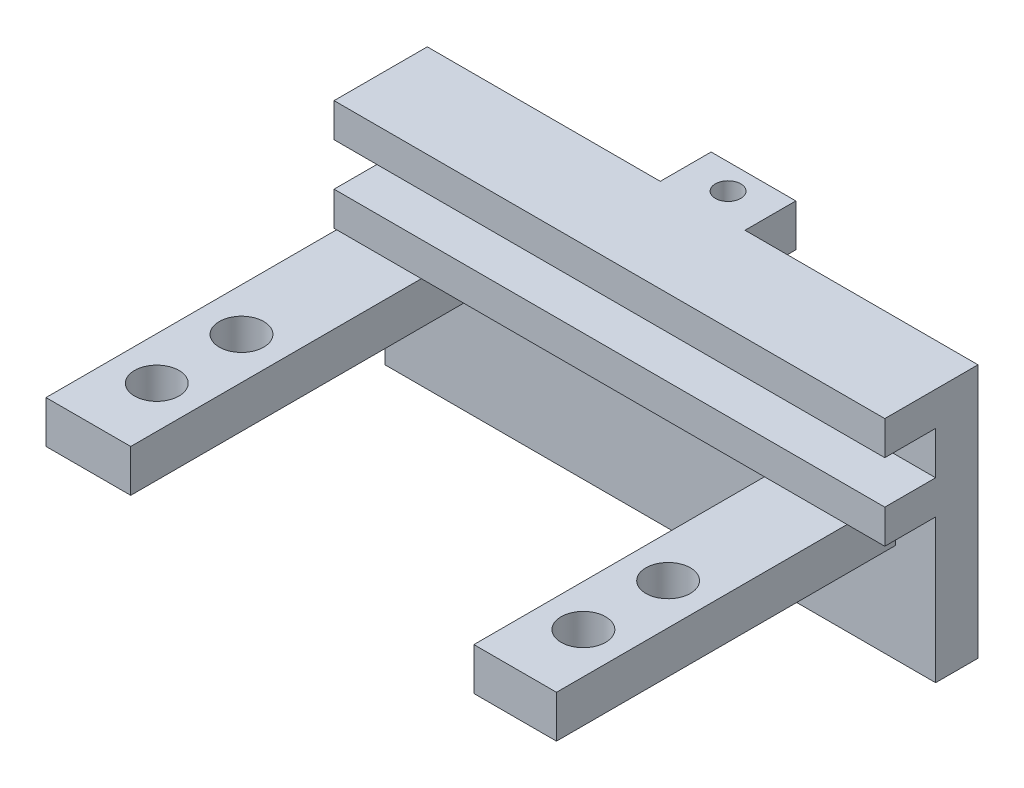
from build123d import *

# Parameters (mm, degrees)
ESQUISSE1_W             = 60
ESQUISSE1_H             = 30
BOSS_EXTRU_1_DEPTH      = 5
ESQUISSE2_W             = 60
ESQUISSE2_H             = 4
BOSS_EXTRU_2_DEPTH      = 6
ESQUISSE3_W             = 5
ESQUISSE3_H             = 5
BOSS_EXTRU_3_DEPTH      = 40
ESQUISSE5_W             = 40
ESQUISSE5_H             = 5
BOSS_EXTRU_4_DEPTH      = 3
ESQUISSE6_W             = 40
ESQUISSE6_H             = 5
BOSS_EXTRU_5_DEPTH      = 3
ESQUISSE7_R             = 2.625
ENL_V_MAT_EXTRU_1_DEPTH = 59.742850629
BOSS_EXTRU_6_DEPTH      = 5
ESQUISSE10_W            = 40
ESQUISSE10_H            = 5
BOSS_EXTRU_7_DEPTH      = 2
ESQUISSE11_W            = 40
ESQUISSE11_H            = 5
BOSS_EXTRU_8_DEPTH      = 1.75
ESQUISSE13_W            = 10
ESQUISSE13_H            = 6
ESQUISSE13_R            = 1.5
BOSS_EXTRU_10_DEPTH     = 5


with BuildPart() as part:
    # Esquisse1 → Boss.-Extru.1 (new body)
    with BuildSketch(Plane.XY):
        Rectangle(ESQUISSE1_W, ESQUISSE1_H)
    extrude(amount=BOSS_EXTRU_1_DEPTH)

    # Esquisse2 → Boss.-Extru.2 (add)
    with BuildSketch(Plane.XY.offset(5)):
        with Locations((0, 13)):
            Rectangle(ESQUISSE2_W, ESQUISSE2_H)
        with Locations((0, 3.95)):
            Rectangle(ESQUISSE2_W, ESQUISSE2_H)
    extrude(amount=BOSS_EXTRU_2_DEPTH)

    # Esquisse3 → Boss.-Extru.3 (add)
    with BuildSketch(Plane.XY.offset(5)):
        with Locations((-27.5, -0.85)):
            Rectangle(ESQUISSE3_W, ESQUISSE3_H)
        with Locations((19.75, -0.85)):
            Rectangle(ESQUISSE3_W, ESQUISSE3_H)
    extrude(amount=BOSS_EXTRU_3_DEPTH)

    # Esquisse5 → Boss.-Extru.4 (add)
    with BuildSketch(Plane.ZY.offset(30)):
        with Locations((25, -0.85)):
            Rectangle(ESQUISSE5_W, ESQUISSE5_H)
    extrude(amount=BOSS_EXTRU_4_DEPTH)

    # Esquisse6 → Boss.-Extru.5 (add)
    with BuildSketch(Plane(origin=(22.25, 0, 0), x_dir=(0, 0, -1), z_dir=(1, 0, 0))):
        with Locations((-25, -0.85)):
            Rectangle(ESQUISSE6_W, ESQUISSE6_H)
    extrude(amount=BOSS_EXTRU_5_DEPTH)

    # Esquisse7 → Enlèv. mat.-Extru.1 (cut, through all)
    with BuildSketch(Plane.XZ.offset(3.35)):
        with Locations(Location((20.425, 37, 0), (0, 0, 270))):
            Circle(ESQUISSE7_R)
        with Locations(Location((20.425, 27, 0), (0, 0, 270))):
            Circle(ESQUISSE7_R)
        with Locations(Location((-29.925, 27, 0), (0, 0, 270))):
            Circle(ESQUISSE7_R)
        with Locations(Location((-29.925, 37, 0), (0, 0, 270))):
            Circle(ESQUISSE7_R)
    extrude(amount=-ENL_V_MAT_EXTRU_1_DEPTH, mode=Mode.SUBTRACT)

    # Esquisse9 → Boss.-Extru.6 (add)
    with BuildSketch(Plane.ZY.offset(30)):
        Polygon((5, -3.35), (5, 1.65), (5, 1.95), (11, 1.95), (11, 5.95), (5, 5.95), (5, 11), (11, 11), (11, 15), (0, 15), (0, -15), (5, -15), align=None)
    extrude(amount=BOSS_EXTRU_6_DEPTH)

    # Esquisse10 → Boss.-Extru.7 (add, through all)
    with BuildSketch(Plane.ZY.offset(33)):
        with Locations((25, -0.85)):
            Rectangle(ESQUISSE10_W, ESQUISSE10_H)
    extrude(amount=BOSS_EXTRU_7_DEPTH)

    # Esquisse11 → Boss.-Extru.8 (add)
    with BuildSketch(Plane.ZY.offset(-17.25)):
        with Locations((25, -0.85)):
            Rectangle(ESQUISSE11_W, ESQUISSE11_H)
    extrude(amount=BOSS_EXTRU_8_DEPTH)

    # Esquisse13 → Boss.-Extru.10 (add)
    with BuildSketch(Plane(origin=(0, 15, 0), x_dir=(1, 0, 0), z_dir=(0, 1, 0))):
        with Locations((-2.5, 3)):
            Rectangle(ESQUISSE13_W, ESQUISSE13_H)
        with Locations(Location((-2.5, 3, 0), (0, 0, 270))):
            Circle(ESQUISSE13_R, mode=Mode.SUBTRACT)
    extrude(amount=-BOSS_EXTRU_10_DEPTH)


solid = part.part
